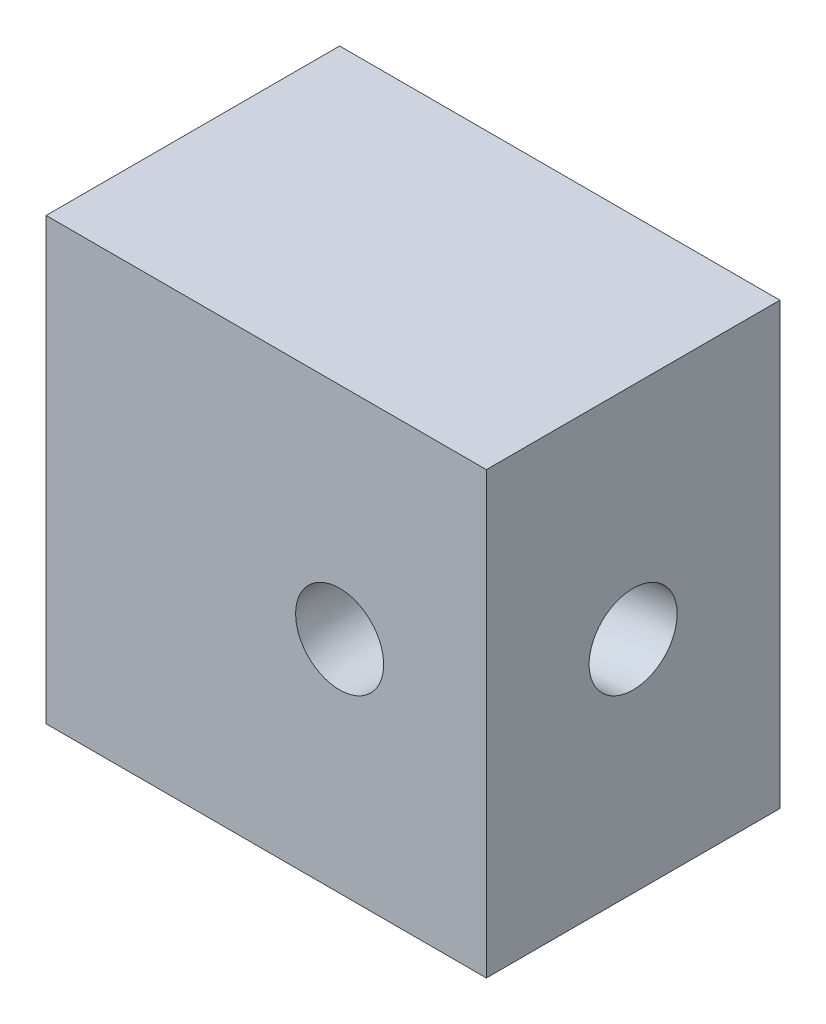
from build123d import *

# Parameters (mm, degrees)
SKETCH2_W           = 76.2
SKETCH2_H           = 76.2
BOSS_EXTRUDE1_DEPTH = 50.8
SKETCH3_R           = 7.62


with BuildPart() as part:
    # Sketch2 → Boss-Extrude1 (new body)
    with BuildSketch(Plane.XY):
        Rectangle(SKETCH2_W, SKETCH2_H)
    extrude(amount=BOSS_EXTRUDE1_DEPTH)

    # Sketch3 → Cut-Revolve1 (revolve, cut)
    with BuildSketch(Plane.XY.offset(50.8), mode=Mode.PRIVATE) as cut_revolve1_sk:
        with Locations((12.7, 0)):
            Circle(SKETCH3_R)
    revolve(cut_revolve1_sk.sketch.rotate(Axis((38.1, 38.1, 50.8), (0, 1, 0)), 315), axis=Axis((38.1, 38.1, 50.8), (0, 1, 0)), mode=Mode.SUBTRACT)


solid = part.part
